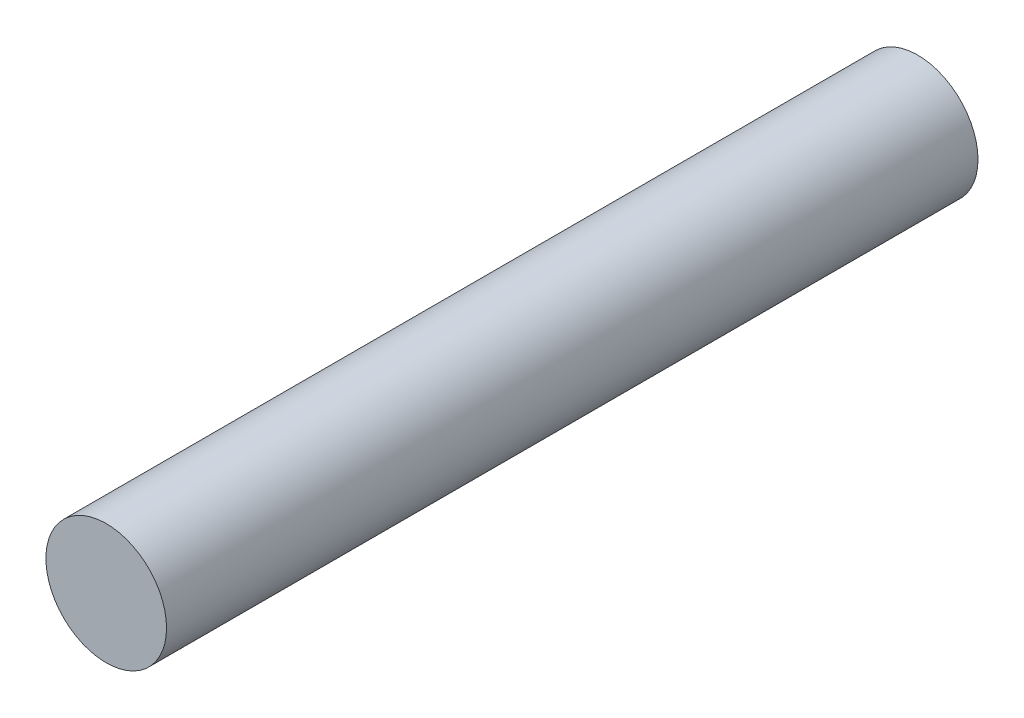
from build123d import *

# Parameters (mm, degrees)
SKETCH1_R           = 6.25
BOSS_EXTRUDE1_DEPTH = 84.07


with BuildPart() as part:
    # Sketch1 → Boss-Extrude1 (new body)
    with BuildSketch(Plane.XY):
        Circle(SKETCH1_R)
    extrude(amount=BOSS_EXTRUDE1_DEPTH)


solid = part.part
